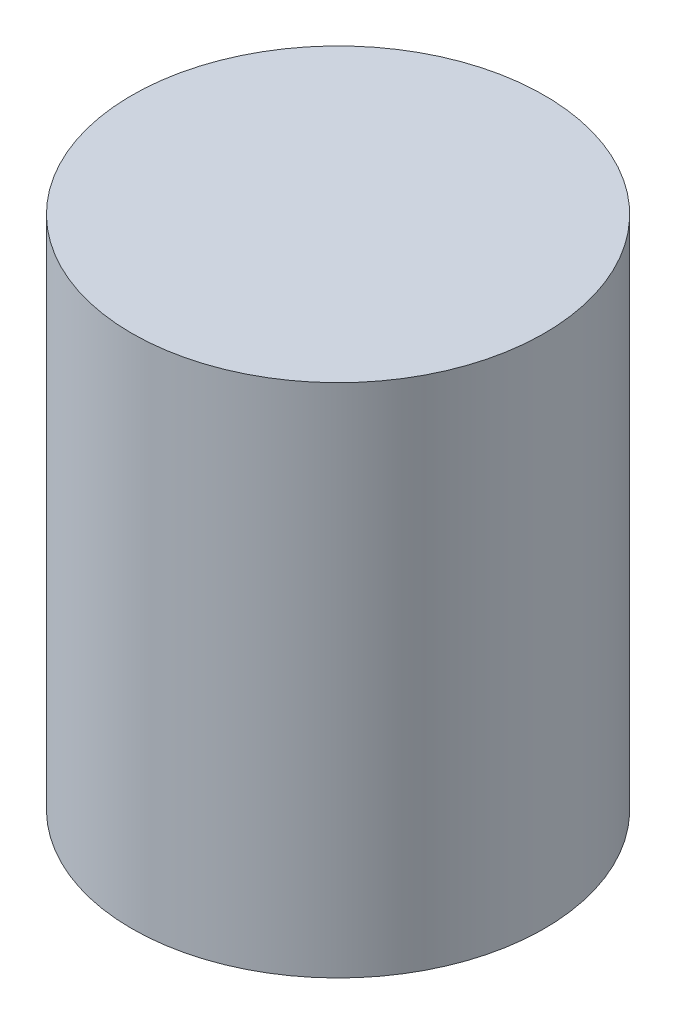
from build123d import *

# Parameters (mm, degrees)
SKETCH1_R           = 40
BOSS_EXTRUDE1_DEPTH = 100


with BuildPart() as part:
    # Sketch1 → Boss-Extrude1 (new body)
    with BuildSketch(Plane(origin=(0, 0, 0), x_dir=(1, 0, 0), z_dir=(0, 1, 0))):
        with Locations(Location((0, 0, 0), (0, 0, 270))):
            Circle(SKETCH1_R)
    extrude(amount=BOSS_EXTRUDE1_DEPTH)


solid = part.part
